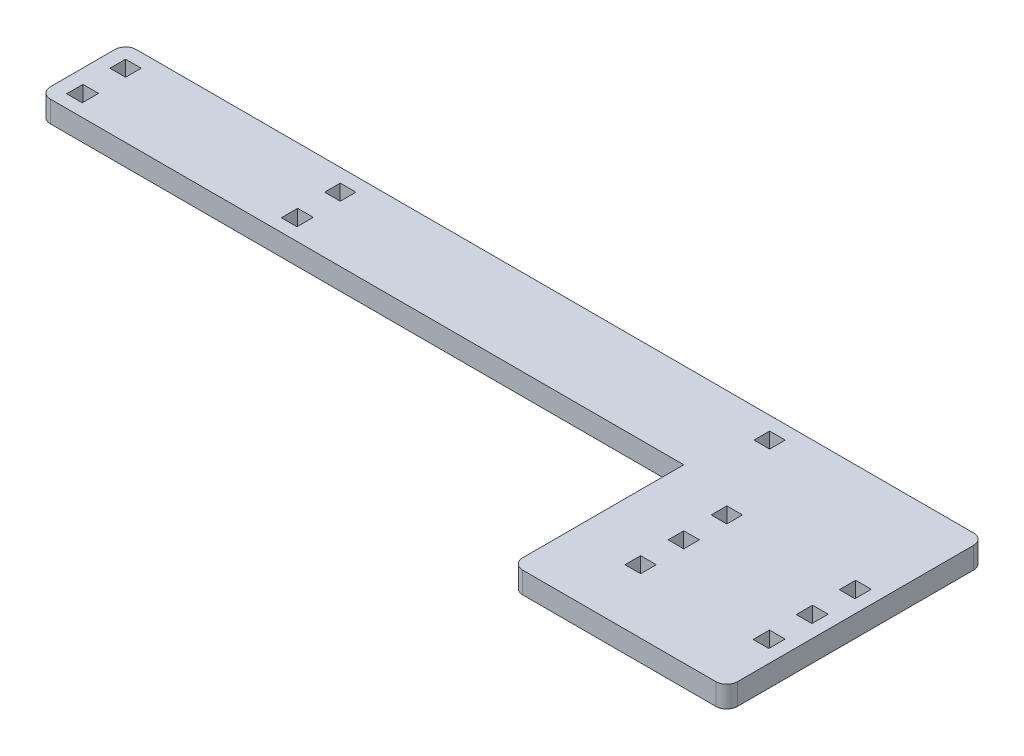
from build123d import *

# Parameters (mm, degrees)
SKETCH1_W           = 4.6228
SKETCH1_H           = 4.819787269
SKETCH1_H_2         = 4.6228
BOSS_EXTRUDE1_DEPTH = 6.35
FILLET2_R           = 3.175
FILLET3_R           = 3.175


with BuildPart() as part:
    # Sketch1 → Boss-Extrude1 (new body)
    with BuildSketch(Plane(origin=(0, 0, 0), x_dir=(1, 0, 0), z_dir=(0, 1, 0))):
        Polygon((0, 0), (254, 0), (254, -76.2), (190.5, -76.2), (190.5, -25.4), (0, -25.4), align=None)
        with Locations((6.522414475, -19.224693634)):
            Rectangle(SKETCH1_W, SKETCH1_H, mode=Mode.SUBTRACT)
        with Locations((6.3754, -6.3754)):
            Rectangle(SKETCH1_W, SKETCH1_H_2, mode=Mode.SUBTRACT)
        with Locations((69.8754, -6.3754)):
            Rectangle(SKETCH1_W, SKETCH1_H_2, mode=Mode.SUBTRACT)
        with Locations((70.022414475, -19.224693634)):
            Rectangle(SKETCH1_W, SKETCH1_H, mode=Mode.SUBTRACT)
        with Locations((196.8754, -6.3754)):
            Rectangle(SKETCH1_W, SKETCH1_H_2, mode=Mode.SUBTRACT)
        with Locations((247.822414475, -31.974693634)):
            Rectangle(SKETCH1_W, SKETCH1_H, mode=Mode.SUBTRACT)
        with Locations((247.822414475, -44.724693634)):
            Rectangle(SKETCH1_W, SKETCH1_H, mode=Mode.SUBTRACT)
        with Locations((247.822414475, -57.474693634)):
            Rectangle(SKETCH1_W, SKETCH1_H, mode=Mode.SUBTRACT)
        with Locations((209.722414475, -31.8762)):
            Rectangle(SKETCH1_W, SKETCH1_H_2, mode=Mode.SUBTRACT)
        with Locations((209.722414475, -44.6262)):
            Rectangle(SKETCH1_W, SKETCH1_H_2, mode=Mode.SUBTRACT)
        with Locations((209.722414475, -57.3762)):
            Rectangle(SKETCH1_W, SKETCH1_H_2, mode=Mode.SUBTRACT)
    extrude(amount=BOSS_EXTRUDE1_DEPTH)

    # Fillet2
    fillet2_edges = [part.edges().sort_by_distance(p)[0] for p in [
        (0, 3.175, 25.4),
    ]]
    fillet(fillet2_edges, radius=FILLET2_R)

    # Fillet3
    fillet3_edges = [part.edges().sort_by_distance(p)[0] for p in [
        (0, 3.175, 0),
        (254, 3.175, 0),
        (254, 3.175, 76.2),
        (190.5, 3.175, 76.2),
    ]]
    fillet(fillet3_edges, radius=FILLET3_R)


solid = part.part
